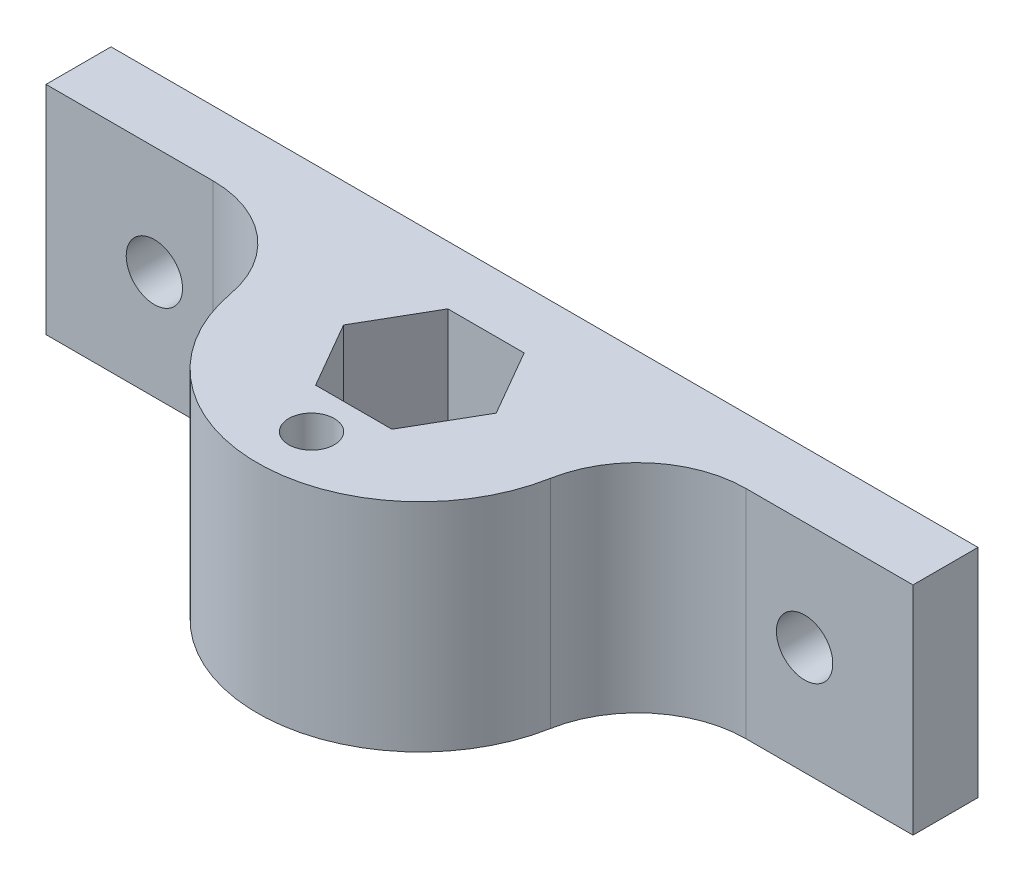
from build123d import *

# Parameters (mm, degrees)
BOSS_EXTRUDE1_DEPTH = 20
FILLET1_R           = 10
CUT_EXTRUDE1_DEPTH  = 52.983170353
SKETCH3_R           = 2.1
CUT_EXTRUDE2_DEPTH  = 52.983170353
SKETCH4_R           = 2.6
CUT_EXTRUDE3_DEPTH  = 52.983170353


with BuildPart() as part:
    # Sketch1 → Boss-Extrude1 (new body)
    with BuildSketch(Plane(origin=(0, 0, 0), x_dir=(1, 0, 0), z_dir=(0, 1, 0))):
        with BuildLine():
            Line((0, 0), (40, 0))
            Line((40, 0), (40, -6))
            Line((40, -6), (13.955285737, -6))
            ThreePointArc((13.955285737, -6), (0, -26.5), (-13.955285737, -6))
            Line((-13.955285737, -6), (-40, -6))
            Line((-40, -6), (-40, 0))
            Line((-40, 0), (0, 0))
        make_face()
    extrude(amount=BOSS_EXTRUDE1_DEPTH)

    # Fillet1
    fillet1_edges = [part.edges().sort_by_distance(p)[0] for p in [
        (13.955285737, 10, 6),
        (-13.955285737, 10, 6),
    ]]
    fillet(fillet1_edges, radius=FILLET1_R)

    # Sketch2 → Cut-Extrude1 (cut, through all)
    with BuildSketch(Plane(origin=(0, 20, 0), x_dir=(1, 0, 0), z_dir=(0, 1, 0))):
        Polygon((-7.043673284, -11.5), (-3.521836642, -17.6), (3.521836642, -17.6), (7.043673284, -11.5), (3.521836642, -5.4), (-3.521836642, -5.4), align=None)
    extrude(amount=-CUT_EXTRUDE1_DEPTH, mode=Mode.SUBTRACT)

    # Sketch3 → Cut-Extrude2 (cut, through all)
    with BuildSketch(Plane(origin=(0, 20, 0), x_dir=(1, 0, 0), z_dir=(0, 1, 0))):
        with Locations(Location((0, -21.5, 0), (0, 0, 270))):
            Circle(SKETCH3_R)
    extrude(amount=-CUT_EXTRUDE2_DEPTH, mode=Mode.SUBTRACT)

    # Sketch4 → Cut-Extrude3 (cut, through all)
    with BuildSketch(Plane(origin=(0, 0, 0), x_dir=(-1, 0, 0), z_dir=(0, 0, -1))):
        with Locations((-30, 10)):
            Circle(SKETCH4_R)
        with Locations((30, 10)):
            Circle(SKETCH4_R)
    extrude(amount=-CUT_EXTRUDE3_DEPTH, mode=Mode.SUBTRACT)


solid = part.part
